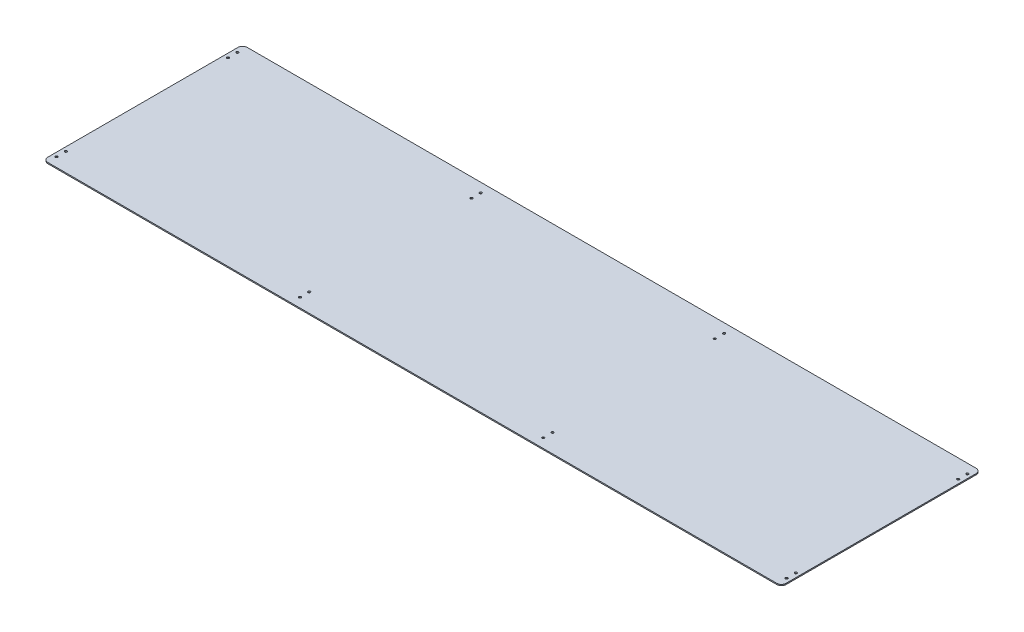
from build123d import *

# Parameters (mm, degrees)
SKETCH1_R           = 3.175
BOSS_EXTRUDE1_DEPTH = 3.175


with BuildPart() as part:
    # Sketch1 → Boss-Extrude1 (new body)
    with BuildSketch(Plane(origin=(0, 0, 0), x_dir=(1, 0, 0), z_dir=(0, 1, 0))):
        with BuildLine():
            Line((12.7, 0), (2009.775, 0))
            ThreePointArc((2009.775, 0), (2018.755256121, 3.719743879), (2022.475, 12.7))
            Line((2022.475, 12.7), (2022.475, 533.4))
            ThreePointArc((2022.475, 533.4), (2018.755256121, 542.380256121), (2009.775, 546.1))
            Line((2009.775, 546.1), (12.7, 546.1))
            ThreePointArc((12.7, 546.1), (3.719743879, 542.380256121), (0, 533.4))
            Line((0, 533.4), (0, 12.7))
            ThreePointArc((0, 12.7), (3.719743879, 3.719743879), (12.7, 0))
        make_face()
        with Locations(Location((11.1125, 520.7, 0), (0, 0, 270))):
            Circle(SKETCH1_R, mode=Mode.SUBTRACT)
        with Locations(Location((11.1125, 495.3, 0), (0, 0, 270))):
            Circle(SKETCH1_R, mode=Mode.SUBTRACT)
        with Locations(Location((11.1125, 50.8, 0), (0, 0, 270))):
            Circle(SKETCH1_R, mode=Mode.SUBTRACT)
        with Locations(Location((11.1125, 25.4, 0), (0, 0, 270))):
            Circle(SKETCH1_R, mode=Mode.SUBTRACT)
        with Locations(Location((677.8625, 520.7, 0), (0, 0, 270))):
            Circle(SKETCH1_R, mode=Mode.SUBTRACT)
        with Locations(Location((677.8625, 495.3, 0), (0, 0, 270))):
            Circle(SKETCH1_R, mode=Mode.SUBTRACT)
        with Locations(Location((677.8625, 50.8, 0), (0, 0, 270))):
            Circle(SKETCH1_R, mode=Mode.SUBTRACT)
        with Locations(Location((677.8625, 25.4, 0), (0, 0, 270))):
            Circle(SKETCH1_R, mode=Mode.SUBTRACT)
        with Locations(Location((1344.6125, 520.7, 0), (0, 0, 270))):
            Circle(SKETCH1_R, mode=Mode.SUBTRACT)
        with Locations(Location((1344.6125, 495.3, 0), (0, 0, 270))):
            Circle(SKETCH1_R, mode=Mode.SUBTRACT)
        with Locations(Location((1344.6125, 50.8, 0), (0, 0, 270))):
            Circle(SKETCH1_R, mode=Mode.SUBTRACT)
        with Locations(Location((1344.6125, 25.4, 0), (0, 0, 270))):
            Circle(SKETCH1_R, mode=Mode.SUBTRACT)
        with Locations(Location((2011.3625, 520.7, 0), (0, 0, 270))):
            Circle(SKETCH1_R, mode=Mode.SUBTRACT)
        with Locations(Location((2011.3625, 495.3, 0), (0, 0, 270))):
            Circle(SKETCH1_R, mode=Mode.SUBTRACT)
        with Locations(Location((2011.3625, 50.8, 0), (0, 0, 270))):
            Circle(SKETCH1_R, mode=Mode.SUBTRACT)
        with Locations(Location((2011.3625, 25.4, 0), (0, 0, 270))):
            Circle(SKETCH1_R, mode=Mode.SUBTRACT)
    extrude(amount=BOSS_EXTRUDE1_DEPTH)


solid = part.part
